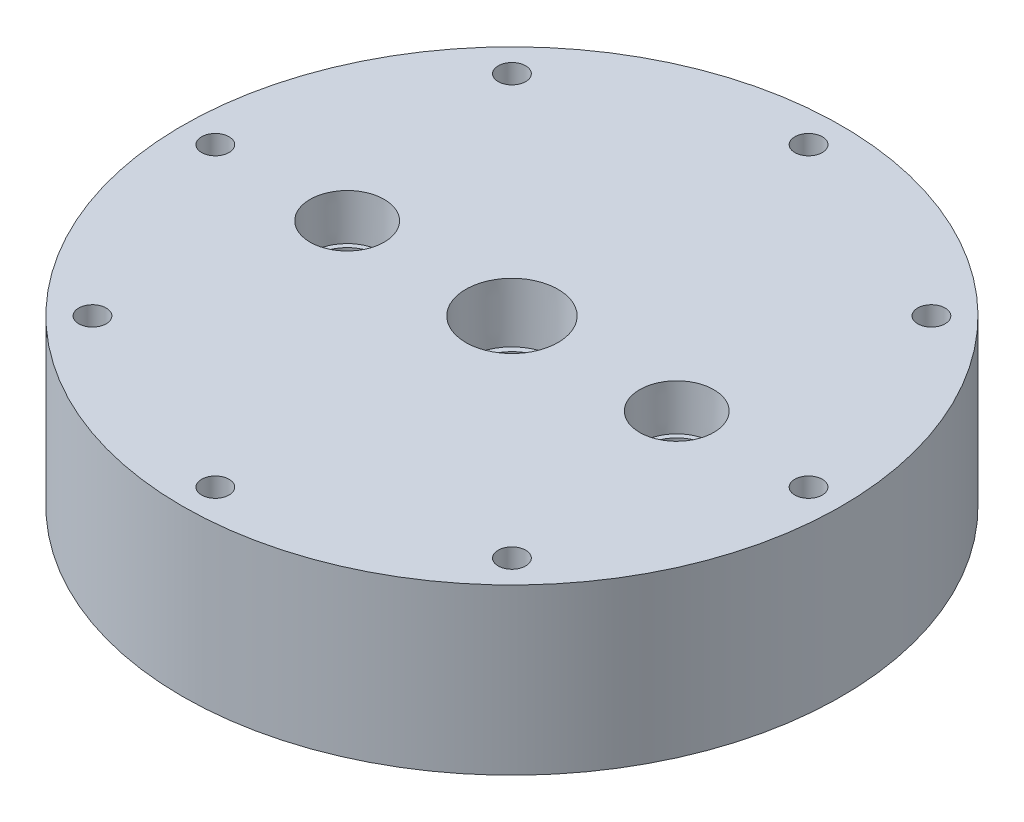
from build123d import *

# Parameters (mm, degrees)
SKETCH1_R                                      = 76.2
BILLET_DEPTH                                   = 50.8
SKETCH3_R                                      = 28.575
LOX_PLATE_DEPTH                                = 17.78
SKETCH5_R                                      = 22.225
LOX_DOME_DEPTH                                 = 4.46278
SKETCH7_R                                      = 76.2
TOP_MILL_DEPTH                                 = 12.7
F_1_4_BOLT_HOLE_REACH                          = 116.3
SKETCH11_R                                     = 3.175
BOLT_PATTERN_COUNT                             = 8
SKETCH12_R                                     = 60.96
KEROSENE_PLATE_DEPTH                           = 12.7
SKETCH26_R                                     = 27.94
SKETCH26_R_2                                   = 25.4
LOX_PLATE_O_RING_DEPTH                         = 2.032
KEROSENE_INLET_3_8_NPT_TAPPED_HOLE1_AT_2_COUNT = 2
KEROSENE_INLET_3_8_NPT_TAPPED_HOLE1_AT_2_PITCH = 76.2
SKETCH27_R                                     = 1.190625
CUT_EXTRUDE1_DEPTH                             = 3.175


with BuildPart() as part:
    # Sketch1 → Billet (new body)
    with BuildSketch(Plane(origin=(0, 0, 0), x_dir=(1, 0, 0), z_dir=(0, 1, 0))):
        Circle(SKETCH1_R)
    extrude(amount=-BILLET_DEPTH)

    # Sketch3 → Lox Plate (cut)
    with BuildSketch(Plane(origin=(0, -50.8, 0), x_dir=(1, 0, 0), z_dir=(0, 1, 0))):
        Circle(SKETCH3_R)
    extrude(amount=LOX_PLATE_DEPTH, mode=Mode.SUBTRACT)

    # Sketch5 → Lox Dome (cut)
    with BuildSketch(Plane(origin=(0, -33.02, 0), x_dir=(1, 0, 0), z_dir=(0, 1, 0))):
        Circle(SKETCH5_R)
    extrude(amount=LOX_DOME_DEPTH, mode=Mode.SUBTRACT)

    # Sketch7 → Top Mill (cut)
    with BuildSketch(Plane(origin=(0, 0, 0), x_dir=(1, 0, 0), z_dir=(0, 1, 0))):
        Circle(SKETCH7_R)
    extrude(amount=-TOP_MILL_DEPTH, mode=Mode.SUBTRACT)

    # Sketch11 → 1/4" Bolt Hole (cut, up to next)
    with BuildSketch(Plane(origin=(0, -50.8, 0), x_dir=(1, 0, 0), z_dir=(0, 1, 0)), mode=Mode.PRIVATE) as f_1_4_bolt_hole_sk1:
        with Locations((0, 68.58)):
            Circle(SKETCH11_R)
    f_1_4_bolt_hole_tool1 = extrude(f_1_4_bolt_hole_sk1.sketch, amount=F_1_4_BOLT_HOLE_REACH, mode=Mode.PRIVATE) & part.part
    f_1_4_bolt_hole = f_1_4_bolt_hole_tool1.solids().sort_by_distance((0, -50.8, -68.58))[0]
    add(f_1_4_bolt_hole, mode=Mode.SUBTRACT)

    # Bolt Pattern: 1/4" Bolt Hole ×8 about axis
    bolt_pattern_axis = Axis((0, 53.34, 0), (0, -1, 0))
    for i in range(1, BOLT_PATTERN_COUNT):
        add(f_1_4_bolt_hole.rotate(bolt_pattern_axis, i * 360 / BOLT_PATTERN_COUNT), mode=Mode.SUBTRACT)

    # Sketch12 → Kerosene Plate (cut)
    with BuildSketch(Plane(origin=(0, -50.8, 0), x_dir=(1, 0, 0), z_dir=(0, 1, 0))):
        Circle(SKETCH12_R)
    extrude(amount=KEROSENE_PLATE_DEPTH, mode=Mode.SUBTRACT)

    # Sketch21 → Lox Inlet-1/2 NPT Tapped Hole3 (revolve, cut)
    with BuildSketch(Plane(origin=(0, -12.7, 0), x_dir=(0, 0, 1), z_dir=(1, 0, 0))):
        Polygon((0, 0), (0, 38.1), (8.9281, 38.1), (8.9281, 13.462), (10.261665792, 13.462), (10.6647361, 0), align=None)
    revolve(axis=Axis((0, -6.35, 0), (0, -1, 0)), mode=Mode.SUBTRACT)

    # Sketch26 → Lox Plate O Ring (cut)
    with BuildSketch(Plane.XZ.offset(33.02)):
        Circle(SKETCH26_R)
        Circle(SKETCH26_R_2, mode=Mode.SUBTRACT)
    extrude(amount=-LOX_PLATE_O_RING_DEPTH, mode=Mode.SUBTRACT)

    # Sketch25 → Kerosene Inlet-3/8 NPT Tapped Hole1 (revolve, cut)
    with BuildSketch(Plane(origin=(-38.1, -12.7, 0), x_dir=(0, 0, 1), z_dir=(1, 0, 0))):
        Polygon((0, 0), (0, 38.1), (7.1374, 38.1), (7.1374, 10.414), (8.263205494, 10.414), (8.5750146, 0), align=None)
    kerosene_inlet_3_8_npt_tapped_hole1 = revolve(axis=Axis((-38.1, -6.35, 0), (0, -1, 0)), mode=Mode.SUBTRACT)

    # Kerosene Inlet-3/8 NPT Tapped Hole1 at 2: Kerosene Inlet-3/8 NPT Tapped Hole1 ×2
    with Locations(*[(i * KEROSENE_INLET_3_8_NPT_TAPPED_HOLE1_AT_2_PITCH, 0, 0) for i in range(1, KEROSENE_INLET_3_8_NPT_TAPPED_HOLE1_AT_2_COUNT)]):
        add(kerosene_inlet_3_8_npt_tapped_hole1, mode=Mode.SUBTRACT)

    # Sketch27 → Cut-Extrude1 (cut)
    with BuildSketch(Plane.XZ.offset(38.1)):
        with Locations((0, 50.8)):
            Circle(SKETCH27_R)
        with Locations((0, -50.8)):
            Circle(SKETCH27_R)
    extrude(amount=-CUT_EXTRUDE1_DEPTH, mode=Mode.SUBTRACT)


solid = part.part
